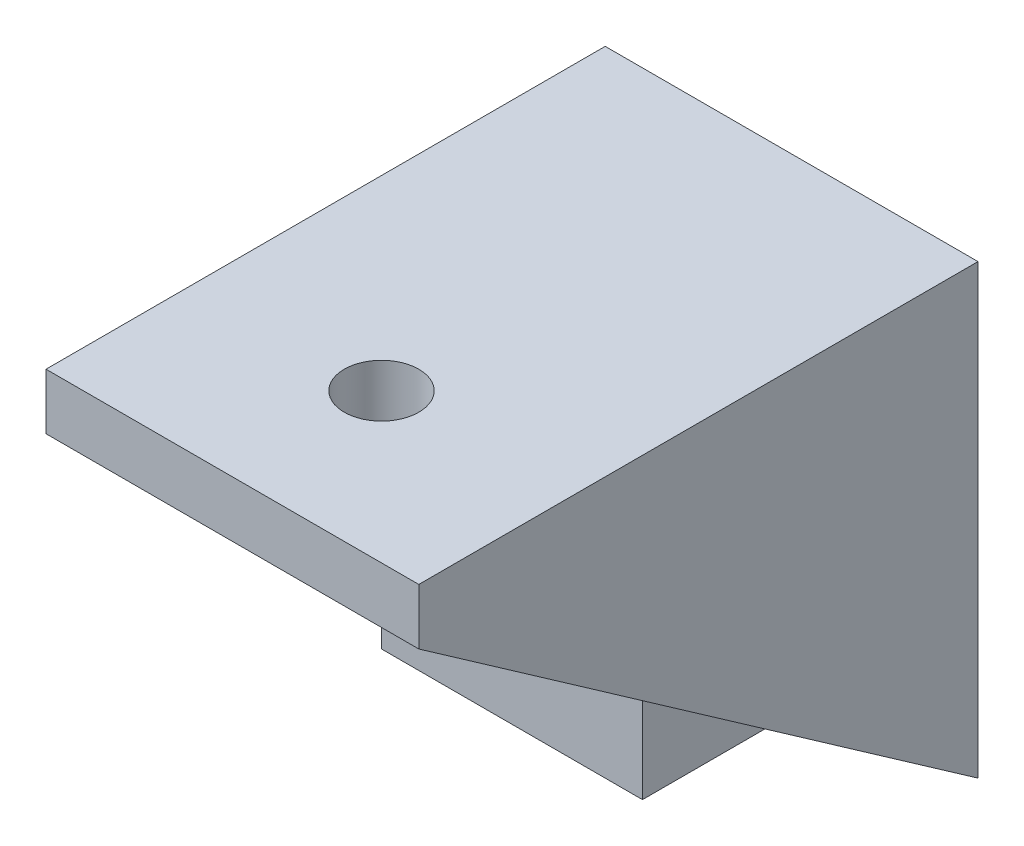
from build123d import *

# Parameters (mm, degrees)
SKETCH1_W           = 20
SKETCH1_H           = 24
BOSS_EXTRUDE1_DEPTH = 30
CUT_EXTRUDE1_DEPTH  = 39
SKETCH3_W           = 16
SKETCH3_H           = 19
CUT_EXTRUDE2_DEPTH  = 27
SKETCH4_W           = 14
SKETCH4_H           = 14
BOSS_EXTRUDE2_DEPTH = 12
SKETCH5_R           = 1.6
CUT_EXTRUDE3_DEPTH  = 34.823069051
SKETCH6_R           = 2
CUT_EXTRUDE4_DEPTH  = 38.960505792


with BuildPart() as part:
    # Sketch1 → Boss-Extrude1 (new body)
    with BuildSketch(Plane.XY):
        Rectangle(SKETCH1_W, SKETCH1_H)
    extrude(amount=BOSS_EXTRUDE1_DEPTH)

    # Sketch2 → Cut-Extrude1 (cut, through all)
    with BuildSketch(Plane(origin=(10, 0, 0), x_dir=(0, 0, -1), z_dir=(1, 0, 0))):
        Polygon((0, -12), (-30, 9), (-30, -12), align=None)
    extrude(amount=-CUT_EXTRUDE1_DEPTH, mode=Mode.SUBTRACT)

    # Sketch3 → Cut-Extrude2 (cut)
    with BuildSketch(Plane.XY.offset(30)):
        with Locations((0, -0.5)):
            Rectangle(SKETCH3_W, SKETCH3_H)
    extrude(amount=-CUT_EXTRUDE2_DEPTH, mode=Mode.SUBTRACT)

    # Sketch4 → Boss-Extrude2 (add)
    with BuildSketch(Plane.XY.offset(3)):
        Rectangle(SKETCH4_W, SKETCH4_H)
    extrude(amount=BOSS_EXTRUDE2_DEPTH)

    # Sketch5 → Cut-Extrude3 (cut, through all)
    with BuildSketch(Plane(origin=(0, 0, 0), x_dir=(-1, 0, 0), z_dir=(0, 0, -1))):
        Circle(SKETCH5_R)
    extrude(amount=-CUT_EXTRUDE3_DEPTH, mode=Mode.SUBTRACT)

    # Sketch6 → Cut-Extrude4 (cut, through all)
    with BuildSketch(Plane.XZ.offset(-9)):
        with Locations(Location((0, 22, 0), (0, 0, 270))):
            Circle(SKETCH6_R)
    extrude(amount=-CUT_EXTRUDE4_DEPTH, mode=Mode.SUBTRACT)


solid = part.part
